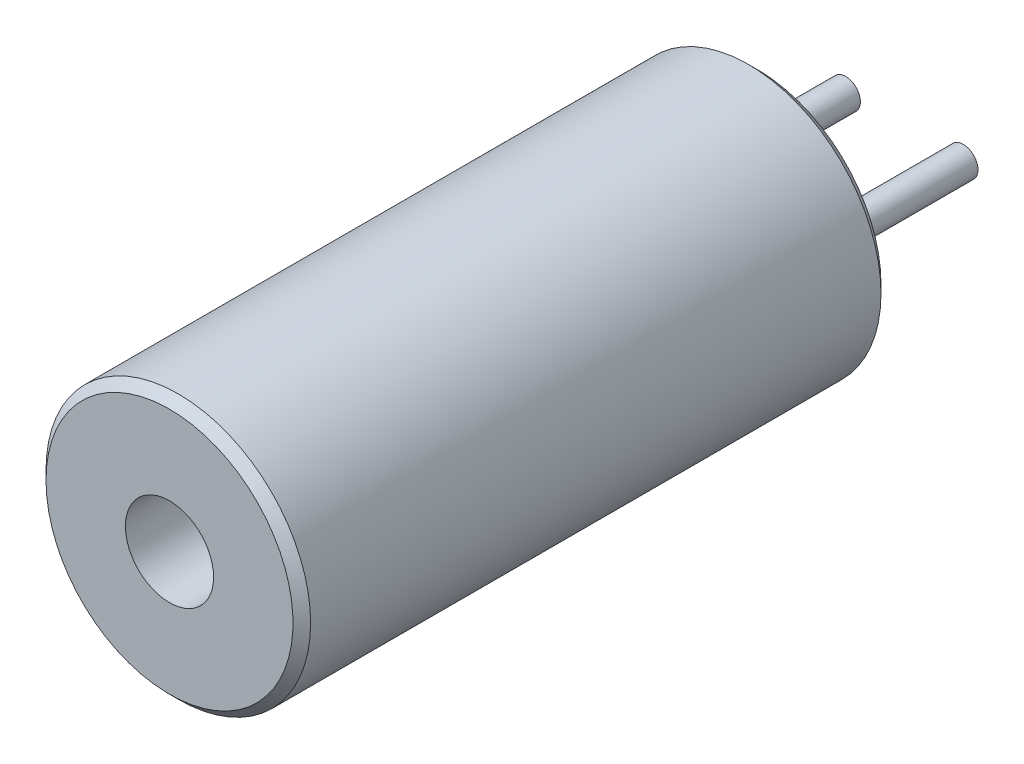
from build123d import *

# Parameters (mm, degrees)
SKETCH1_W           = 20
SKETCH1_H           = 4.5
SKETCH2_R           = 1.5
CUT_EXTRUDE1_DEPTH  = 3
CHAMFER1_SIZE       = 0.3
SKETCH3_R           = 0.5
BOSS_EXTRUDE1_DEPTH = 5


with BuildPart() as part:
    # Sketch1 → Revolve1 (revolve)
    with BuildSketch(Plane(origin=(0, 0, 0), x_dir=(0, 0, -1), z_dir=(1, 0, 0)), mode=Mode.PRIVATE) as revolve1_sk:
        with Locations((0, 2.25)):
            Rectangle(SKETCH1_W, SKETCH1_H)
    revolve(revolve1_sk.sketch.rotate(Axis((0, 0, 10), (0, 0, -1)), 90), axis=Axis((0, 0, 10), (0, 0, -1)))

    # Sketch2 → Cut-Extrude1 (cut)
    with BuildSketch(Plane.XY.offset(10)):
        Circle(SKETCH2_R)
    extrude(amount=-CUT_EXTRUDE1_DEPTH, mode=Mode.SUBTRACT)

    # Chamfer1
    chamfer1_edges = [part.edges().sort_by_distance(p)[0] for p in [
        (-4.5, 0, -10),
        (-4.5, 0, 10),
    ]]
    chamfer(chamfer1_edges, length=CHAMFER1_SIZE)

    # Sketch3 → Boss-Extrude1 (add)
    with BuildSketch(Plane(origin=(0, 0, -10), x_dir=(-1, 0, 0), z_dir=(0, 0, -1))):
        with Locations(Location((-2, 0, 0), (0, 0, 180))):
            Circle(SKETCH3_R)
        with Locations(Location((2, 0, 0), (0, 0, 180))):
            Circle(SKETCH3_R)
    extrude(amount=BOSS_EXTRUDE1_DEPTH)


solid = part.part
